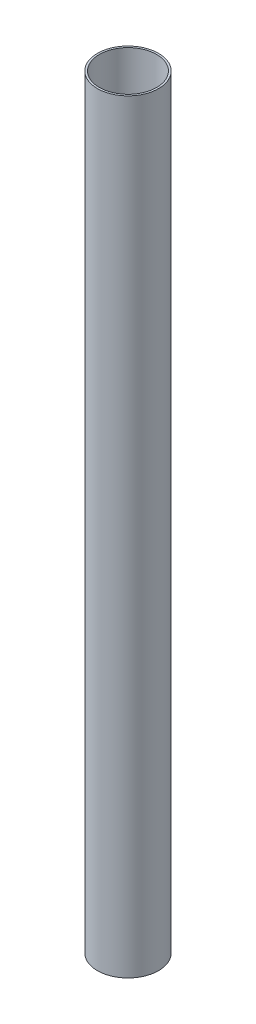
from build123d import *

# Parameters (mm, degrees)
SKETCH_1_R      = 8
SKETCH_1_R_2    = 7.5
EXTRUDE_1_DEPTH = 200


with BuildPart() as part:
    # 草图1 → 凸台-拉伸1 (new body)
    with BuildSketch(Plane(origin=(0, 0, 0), x_dir=(1, 0, 0), z_dir=(0, 1, 0))):
        with Locations(Location((0, 0, 0), (0, 0, 270))):
            Circle(SKETCH_1_R)
        with Locations(Location((0, 0, 0), (0, 0, 270))):
            Circle(SKETCH_1_R_2, mode=Mode.SUBTRACT)
    extrude(amount=EXTRUDE_1_DEPTH)


solid = part.part
